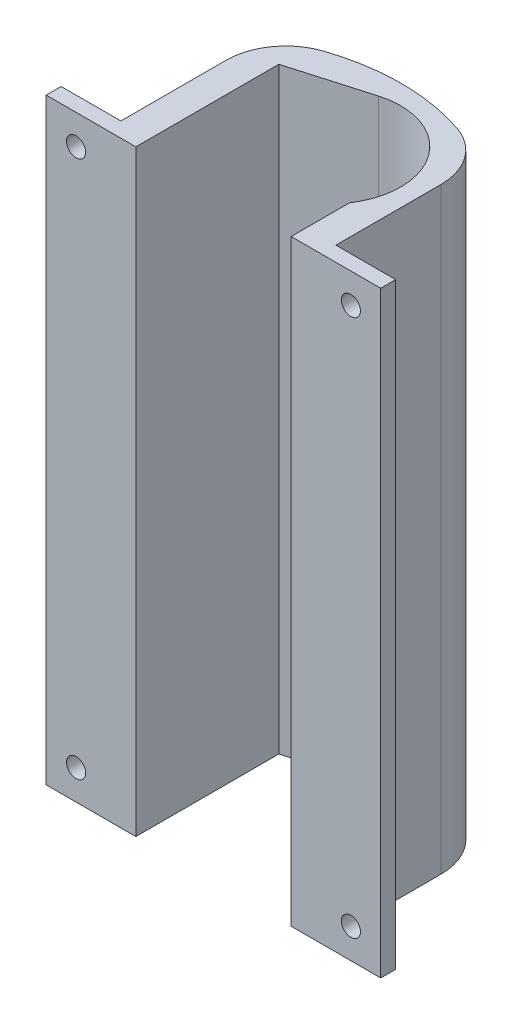
from build123d import *

# Parameters (mm, degrees)
BOSS_EXTRUDE1_DEPTH = 127
FILLET2_R           = 12.7
SKETCH2_R           = 2.032
CUT_EXTRUDE1_DEPTH  = 139.014433952


with BuildPart() as part:
    # Sketch1 → Boss-Extrude1 (new body)
    with BuildSketch(Plane(origin=(0, 0, 0), x_dir=(1, 0, 0), z_dir=(0, 1, 0))):
        with BuildLine():
            Line((12.446, -95.666893232), (12.446, -83.267976842))
            ThreePointArc((12.446, -83.267976842), (12.103082443, -66.082532596), (-4.162019583, -60.523437125))
            Line((-4.162019583, -60.523437125), (-20.574, -65.268050741))
            Line((-20.574, -65.268050741), (-20.574, -84.572180345))
            Line((-20.574, -84.572180345), (-20.574, -95.666893232))
            Line((-20.574, -95.666893232), (-39.624, -95.666893232))
            Line((-39.624, -95.666893232), (-39.624, -92.491893232))
            Line((-39.624, -92.491893232), (-26.924, -92.491893232))
            Line((-26.924, -92.491893232), (-26.924, -62.093050741))
            ThreePointArc((-26.924, -62.093050741), (-4.064, -55.764211531), (18.796, -62.093050741))
            Line((18.796, -62.093050741), (18.796, -92.491893232))
            Line((18.796, -92.491893232), (31.496, -92.491893232))
            Line((31.496, -92.491893232), (31.496, -95.666893232))
            Line((31.496, -95.666893232), (12.446, -95.666893232))
        make_face()
    extrude(amount=BOSS_EXTRUDE1_DEPTH)

    # Fillet2
    fillet2_edges = [part.edges().sort_by_distance(p)[0] for p in [
        (-26.924, 63.5, 62.093050741),
        (18.796, 63.5, 62.093050741),
    ]]
    fillet(fillet2_edges, radius=FILLET2_R)

    # Sketch2 → Cut-Extrude1 (cut, through all)
    with BuildSketch(Plane(origin=(0, 0, 92.491893232), x_dir=(-1, 0, 0), z_dir=(0, 0, -1))):
        with Locations((-25.146, 120.65)):
            Circle(SKETCH2_R)
        with Locations((-25.146, 6.35)):
            Circle(SKETCH2_R)
        with Locations((33.274, 120.65)):
            Circle(SKETCH2_R)
        with Locations((33.274, 6.35)):
            Circle(SKETCH2_R)
    extrude(amount=-CUT_EXTRUDE1_DEPTH, mode=Mode.SUBTRACT)


solid = part.part
